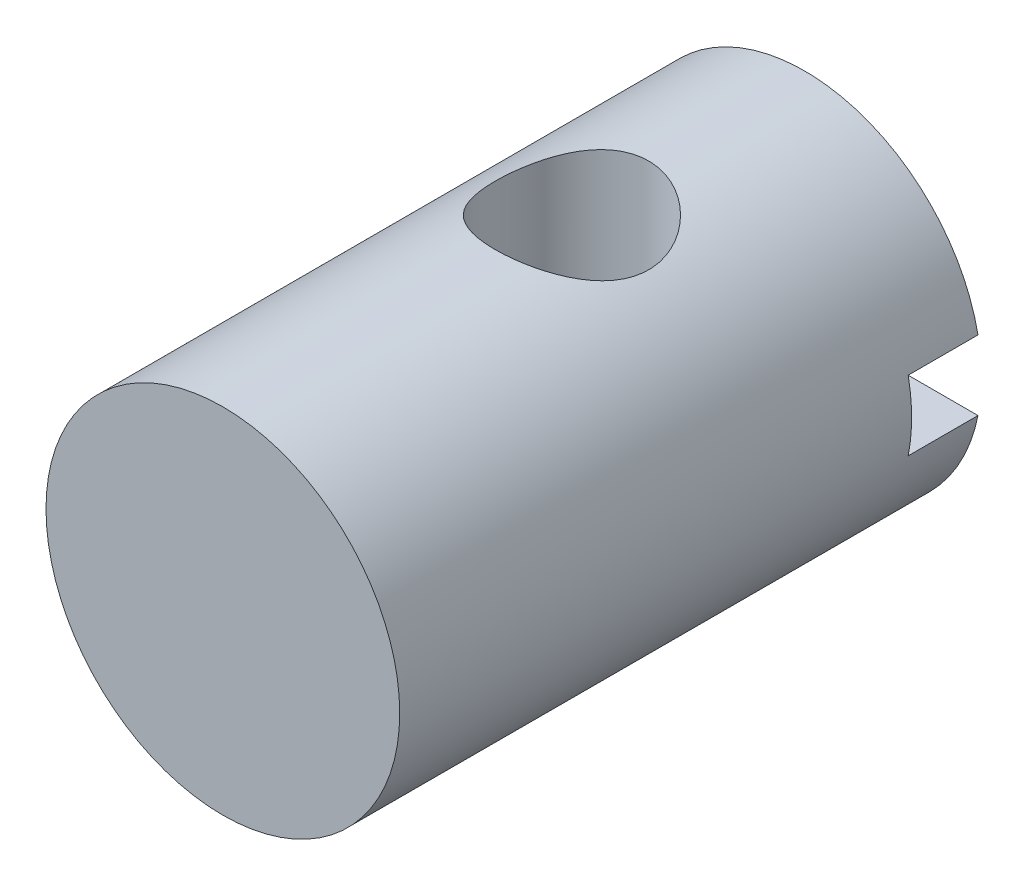
from build123d import *
from build123d.topology import SkipClean

# Parameters (mm, degrees)
SCHIZZO1_W                   = 3.8
SCHIZZO1_H                   = 12.5
TAGLIO_ESTRUSIONE1_START     = -1.5
TAGLIO_ESTRUSIONE1_DEPTH     = 1.5
ESTRUSIONE_ESTRUSIONE1_DEPTH = 1.5
FORO_3_3_3_3_1_D             = 3.3


with BuildPart() as part:
    # Schizzo1 → Rivoluzione1 (revolve)
    with BuildSketch(Plane.XZ, mode=Mode.PRIVATE) as rivoluzione1_sk:
        with Locations((11.9, -7.75)):
            Rectangle(SCHIZZO1_W, SCHIZZO1_H)
    revolve(rivoluzione1_sk.sketch.rotate(Axis((10, 0, -1.5), (0, 0, -1)), 180), axis=Axis((10, 0, -1.5), (0, 0, -1)))

    # Schizzo2 → Taglio-Estrusione1 (cut)
    with BuildSketch(Plane(origin=(0, 0, -14), x_dir=(-1, 0, 0), z_dir=(0, 0, -1)).offset(TAGLIO_ESTRUSIONE1_START)):
        with BuildLine():
            Line((-13.725251669, -0.75), (-6.274748331, -0.75))
            ThreePointArc((-6.274748331, -0.75), (-10, 3.8), (-13.725251669, -0.75))
        make_face()
    extrude(amount=TAGLIO_ESTRUSIONE1_DEPTH, mode=Mode.SUBTRACT)

    # Schizzo3 → Estrusione-Estrusione1 (add)
    with SkipClean():  # the faces are left unmerged after this step: merging them gives an invalid solid
        with BuildSketch(Plane(origin=(0, 0, -12.5), x_dir=(-1, 0, 0), z_dir=(0, 0, -1))):
            with BuildLine():
                Line((-6.274748331, 0.75), (-13.725251669, 0.75))
                ThreePointArc((-13.725251669, 0.75), (-10, 3.8), (-6.274748331, 0.75))
            make_face()
        extrude(amount=ESTRUSIONE_ESTRUSIONE1_DEPTH)

    # Foro Ø3.3 (3.3)-1 (through all)
    with Locations(Plane(origin=(10, 3.8, -9), x_dir=(0, 0, 1), z_dir=(0, 1, 0))):
        with Locations((0, 0)):
            Hole(FORO_3_3_3_3_1_D / 2)


solid = part.part
